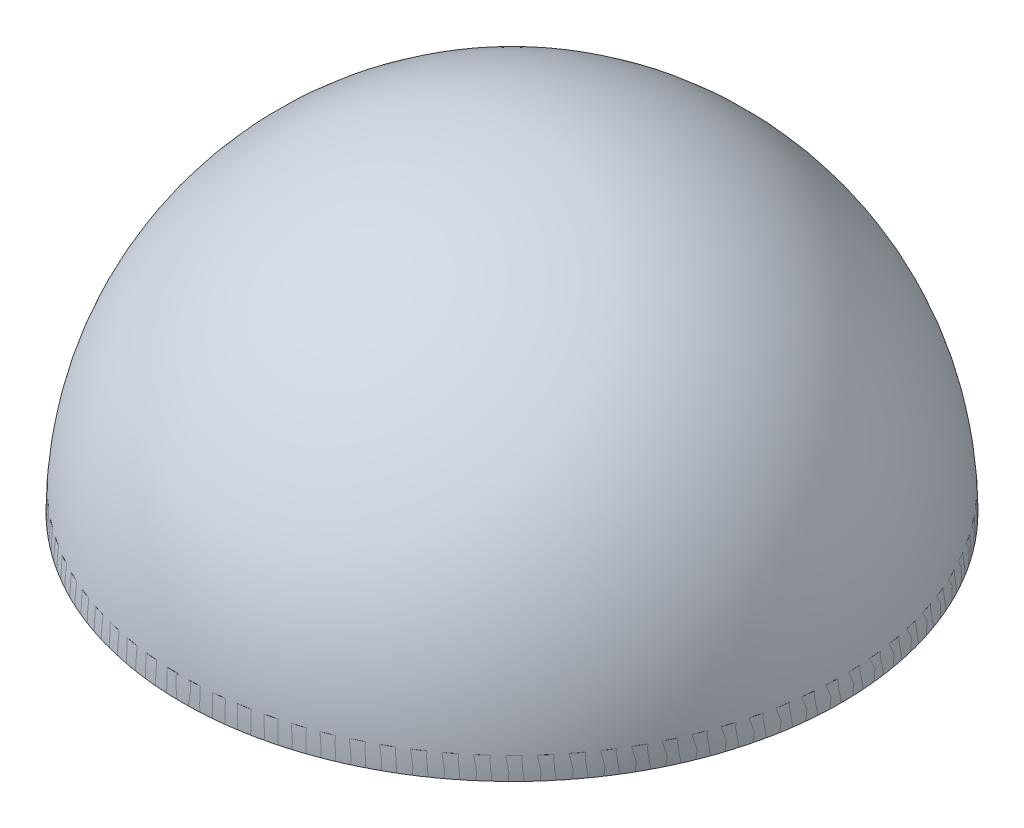
from build123d import *

# Parameters (mm, degrees)
SHELL_ANGLE = 180


with BuildPart() as part:
    # Sketch9 → Shell (revolve)
    with BuildSketch(Plane(origin=(0, 0, 0), x_dir=(1, 0, 0), z_dir=(0, 1, 0))):
        with BuildLine():
            Line((0, 75), (0, 71))
            ThreePointArc((0, 71), (-71, 0), (0, -71))
            Line((0, -71), (0, -75))
            ThreePointArc((0, -75), (-75, 0), (0, 75))
        make_face()
    revolve(axis=Axis((0, 0, -75), (0, 0, -1)), revolution_arc=SHELL_ANGLE)


with BuildPart() as body_2:
    # Sketch4 → Base (revolve)
    with BuildSketch(Plane.XY):
        with BuildLine():
            Line((-75, 0), (-71, 0))
            ThreePointArc((-71, 0), (-70.955917525, 2.501553164), (-70.823724839, 5))
            Line((-70.823724839, 5), (-74.833147735, 5))
            ThreePointArc((-74.833147735, 5), (-74.958275328, 2.501391597), (-75, 0))
        make_face()
    revolve(axis=Axis((0, 0, 0), (0, 1, 0)))


solid = Compound([part.part, body_2.part])
